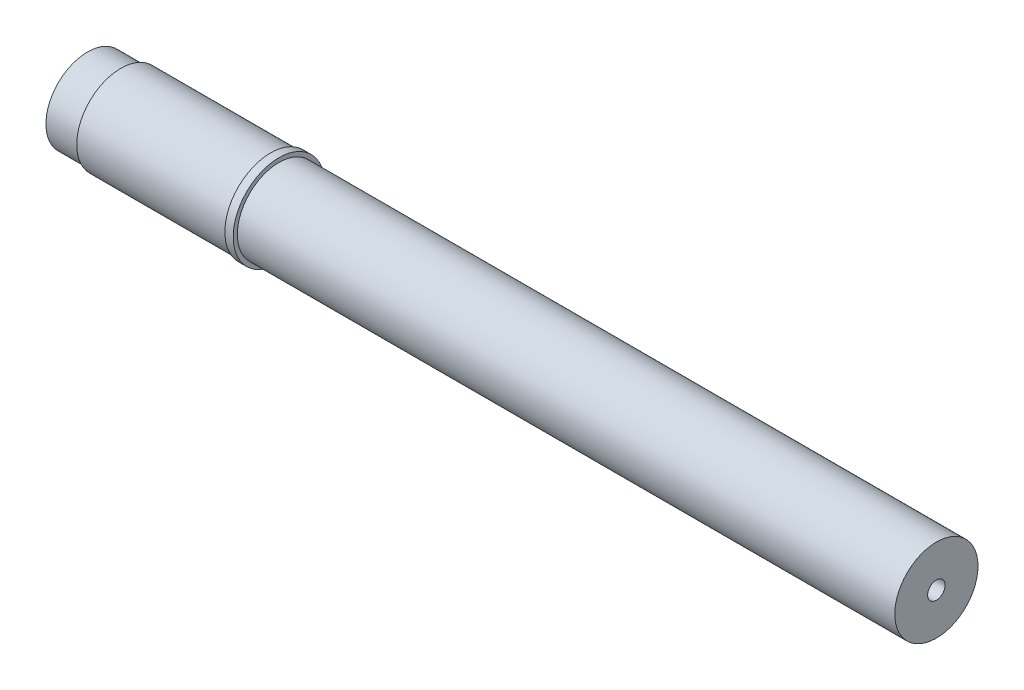
from build123d import *

# Parameters (mm, degrees)
F_10_5_10_5_DIAMETER_HOLE1_D     = 10.5
F_10_5_10_5_DIAMETER_HOLE1_DEPTH = 35
F_10_5_10_5_DIAMETER_HOLE1_TIP   = 3.15451825


with BuildPart() as part:
    # Sketch1 → Revolve1 (revolve)
    with BuildSketch(Plane.XY, mode=Mode.PRIVATE) as revolve1_sk:
        Polygon((-32.34392041, -25), (-12.34392041, -25), (-12.34392041, -26.5), (77.65607959, -26.5), (77.65607959, -27.5), (82.65607959, -27.5), (82.65607959, -25), (477.65607959, -25), (477.65607959, 0), (-32.34392041, 0), align=None)
    revolve(revolve1_sk.sketch.rotate(Axis((477.65607959, 0, 0), (-1, 0, 0)), 270), axis=Axis((477.65607959, 0, 0), (-1, 0, 0)))

    # Ø10.5 (10.5) Diameter Hole1
    with Locations(Plane(origin=(477.65607959, 0, 0), x_dir=(0, 0, 1), z_dir=(1, 0, 0))):
        with Locations((0, 0)):
            Hole(F_10_5_10_5_DIAMETER_HOLE1_D / 2, depth=F_10_5_10_5_DIAMETER_HOLE1_DEPTH)
            with Locations((0, 0, -(F_10_5_10_5_DIAMETER_HOLE1_DEPTH + F_10_5_10_5_DIAMETER_HOLE1_TIP / 2))):  # 118° drill point
                Cone(0, F_10_5_10_5_DIAMETER_HOLE1_D / 2, F_10_5_10_5_DIAMETER_HOLE1_TIP, mode=Mode.SUBTRACT)


solid = part.part
